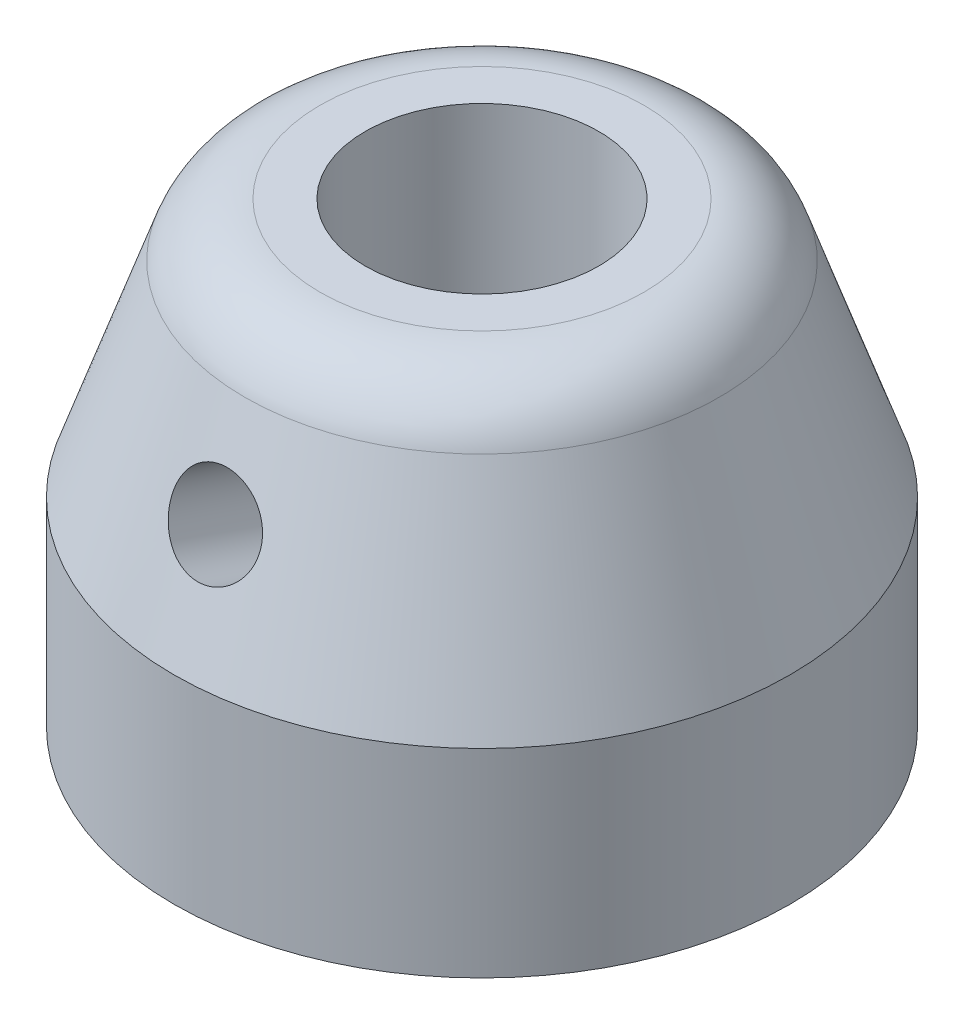
from build123d import *

# Parameters (mm, degrees)
M25X1_5_TAPPED_HOLE1_D     = 23.5
FILLET2_R                  = 8
M10X1_0_TAPPED_HOLE1_D     = 9
M10X1_0_TAPPED_HOLE1_DEPTH = 10
M10X1_0_TAPPED_HOLE1_TIP   = 2.703872786


with BuildPart() as part:
    # Sketch1 → Revolve1 (revolve)
    with BuildSketch(Plane.XY, mode=Mode.PRIVATE) as revolve1_sk:
        Polygon((0, 0), (0, 46), (22, 46), (31, 20), (31, 0), align=None)
    revolve(revolve1_sk.sketch.rotate(Axis((0, 0, 0), (0, 1, 0)), 90), axis=Axis((0, 0, 0), (0, 1, 0)))

    # M25x1.5 Tapped Hole1 (through all)
    with Locations(Plane(origin=(0, 46, 0), x_dir=(1, 0, 0), z_dir=(0, 1, 0))):
        with Locations((0, 0)):
            Hole(M25X1_5_TAPPED_HOLE1_D / 2)

    # Fillet2
    fillet2_edges = [part.edges().sort_by_distance(p)[0] for p in [
        (0, 46, 22),
    ]]
    fillet(fillet2_edges, radius=FILLET2_R)

    # M10x1.0 Tapped Hole1
    with Locations(Plane(origin=(0, 11.722589168, 33.865257596), x_dir=(1, 0, 0), z_dir=(0, 0.3271105638831664, 0.9449860734402581))):
        with Locations((0, 20.576424516)):
            Hole(M10X1_0_TAPPED_HOLE1_D / 2, depth=M10X1_0_TAPPED_HOLE1_DEPTH)
            with Locations((0, 0, -(M10X1_0_TAPPED_HOLE1_DEPTH + M10X1_0_TAPPED_HOLE1_TIP / 2))):  # 118° drill point
                Cone(0, M10X1_0_TAPPED_HOLE1_D / 2, M10X1_0_TAPPED_HOLE1_TIP, mode=Mode.SUBTRACT)

    # Sketch14 → Cut-Revolve1 (revolve, cut)
    with BuildSketch(Plane(origin=(0, 0, 0), x_dir=(0, 0, -1), z_dir=(1, 0, 0))):
        with BuildLine():
            Line((-18.203352341, 0), (0, 0))
            Line((0, 0), (0, 2))
            Line((0, 2), (-12.5, 2))
            ThreePointArc((-12.5, 2), (-15.384211427, 1.092780017), (-18.203352341, 0))
        make_face()
    revolve(axis=Axis((0, 0, 0), (0, 1, 0)), mode=Mode.SUBTRACT)


solid = part.part
